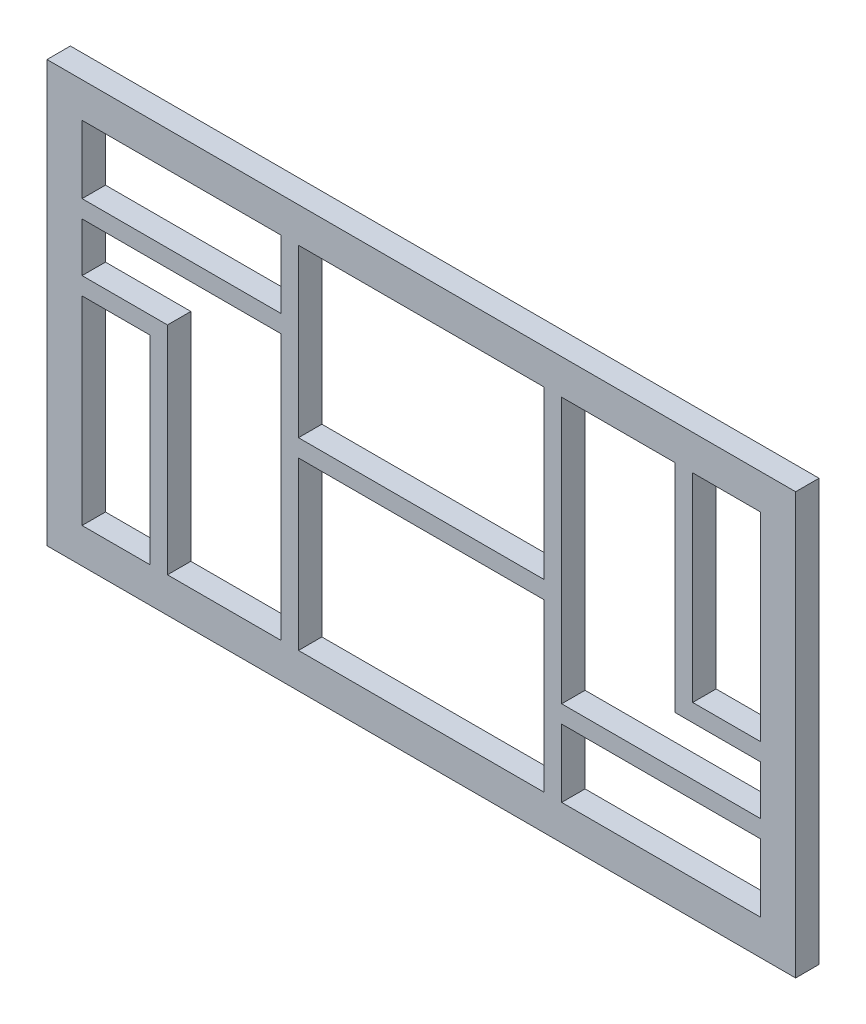
from build123d import *

# Parameters (mm, degrees)
ESBO_O1_W                = 640
ESBO_O1_H                = 360
ESBO_O1_W_2              = 170
ESBO_O1_H_2              = 58
ESBO_O1_W_3              = 58
ESBO_O1_H_3              = 170
RESSALTO_EXTRUS_O1_DEPTH = 20
ESBO_O2_R                = 4
CORTE_EXTRUS_O1_DEPTH    = 15


with BuildPart() as part:
    # Esboço1 → Ressalto-extrusão1 (new body)
    with BuildSketch(Plane.XY):
        with Locations((320, 180)):
            Rectangle(ESBO_O1_W, ESBO_O1_H)
        Polygon((215, 330), (425, 330), (425, 187.5), (215, 187.5), (215, 257), align=None, mode=Mode.SUBTRACT)
        with Locations((115, 301)):
            Rectangle(ESBO_O1_W_2, ESBO_O1_H_2, mode=Mode.SUBTRACT)
        with Locations((59, 115)):
            Rectangle(ESBO_O1_W_3, ESBO_O1_H_3, mode=Mode.SUBTRACT)
        with Locations((581, 245)):
            Rectangle(ESBO_O1_W_3, ESBO_O1_H_3, mode=Mode.SUBTRACT)
        Polygon((200, 257), (30, 257), (30, 215), (88, 215), (103, 215), (103, 30), (200, 30), align=None, mode=Mode.SUBTRACT)
        Polygon((425, 88), (425, 30), (215, 30), (215, 172.5), (425, 172.5), (425, 103), align=None, mode=Mode.SUBTRACT)
        with Locations((525, 59)):
            Rectangle(ESBO_O1_W_2, ESBO_O1_H_2, mode=Mode.SUBTRACT)
        Polygon((440, 103), (610, 103), (610, 145), (537, 145), (537, 160), (537, 330), (440, 330), align=None, mode=Mode.SUBTRACT)
    extrude(amount=RESSALTO_EXTRUS_O1_DEPTH)

    # Esboço2 → Corte-extrusão1 (cut)
    with BuildSketch(Plane(origin=(0, 0, 0), x_dir=(-1, 0, 0), z_dir=(0, 0, -1))):
        with Locations((-179, 337.5)):
            Circle(ESBO_O2_R)
        with Locations((-179, 264.5)):
            Circle(ESBO_O2_R)
        with Locations((-22.5, 179)):
            Circle(ESBO_O2_R)
        with Locations((-95.5, 179)):
            Circle(ESBO_O2_R)
        with Locations((-461, 95.5)):
            Circle(ESBO_O2_R)
        with Locations((-461, 22.5)):
            Circle(ESBO_O2_R)
        with Locations((-544.5, 181)):
            Circle(ESBO_O2_R)
        with Locations((-617.5, 181)):
            Circle(ESBO_O2_R)
    extrude(amount=-CORTE_EXTRUS_O1_DEPTH, mode=Mode.SUBTRACT)


solid = part.part
